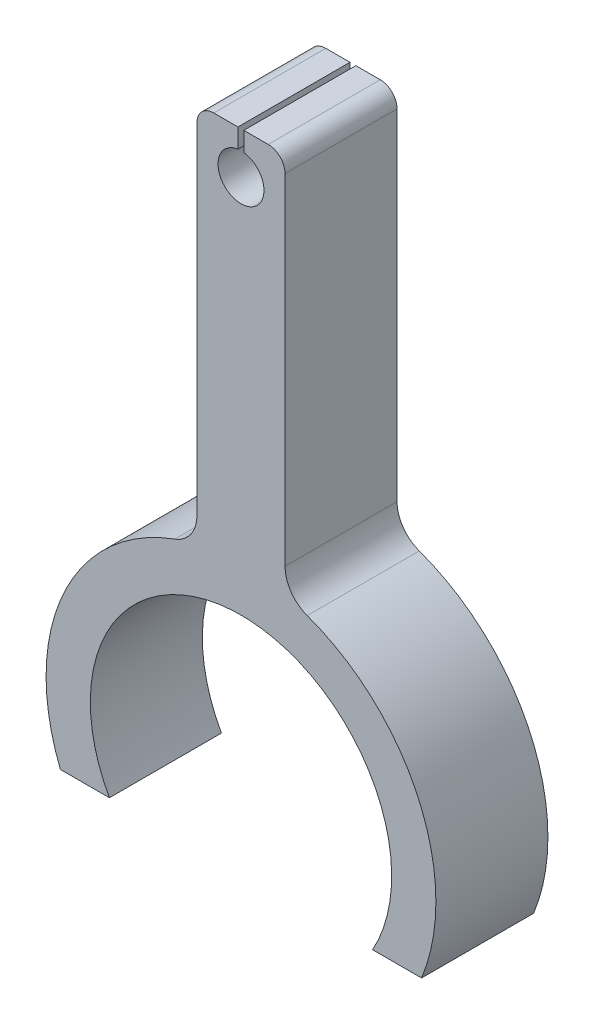
from build123d import *

# Parameters (mm, degrees)
BOSS_EXTRUDE1_DEPTH = 10
FILLET1_R           = 1.5
FILLET2_R           = 3
CUT_EXTRUDE1_DEPTH  = 10


with BuildPart() as part:
    # Sketch1 → Boss-Extrude1 (new body)
    with BuildSketch(Plane.XY):
        with BuildLine():
            Line((3.932919229, 51.05226265), (3.932919229, 16.949694579))
            ThreePointArc((3.932919229, 16.949694579), (15.446427165, 8.010486117), (16.11997205, -6.550305421))
            Line((16.11997205, -6.550305421), (11.747169825, -6.550305421))
            ThreePointArc((11.747169825, -6.550305421), (0, 13.45), (-11.747169825, -6.550305421))
            Line((-11.747169825, -6.550305421), (-16.11997205, -6.550305421))
            ThreePointArc((-16.11997205, -6.550305421), (-15.446427165, 8.010486117), (-3.932919229, 16.949694579))
            Line((-3.932919229, 16.949694579), (-3.932919229, 51.05226265))
            Line((-3.932919229, 51.05226265), (3.932919229, 51.05226265))
        make_face()
    extrude(amount=BOSS_EXTRUDE1_DEPTH)

    # Fillet1
    fillet1_edges = [part.edges().sort_by_distance(p)[0] for p in [
        (-3.932919229, 51.05226265, 5),
        (3.932919229, 51.05226265, 5),
    ]]
    fillet(fillet1_edges, radius=FILLET1_R)

    # Fillet2
    fillet2_edges = [part.edges().sort_by_distance(p)[0] for p in [
        (-3.932919229, 16.949694579, 5),
        (3.932919229, 16.949694579, 5),
    ]]
    fillet(fillet2_edges, radius=FILLET2_R)

    # Sketch3 → Cut-Extrude1 (cut)
    with BuildSketch(Plane.XY.offset(10)):
        with BuildLine():
            Line((-0.269258516, 49.33121061), (-0.269258516, 51.05226265))
            Line((-0.269258516, 51.05226265), (0.251212815, 51.05226265))
            Line((0.251212815, 51.05226265), (0.251212815, 49.333520115))
            ThreePointArc((0.251212815, 49.333520115), (0.009096443, 45.248990685), (-0.269258516, 49.33121061))
        make_face()
    extrude(amount=-CUT_EXTRUDE1_DEPTH, mode=Mode.SUBTRACT)


solid = part.part
